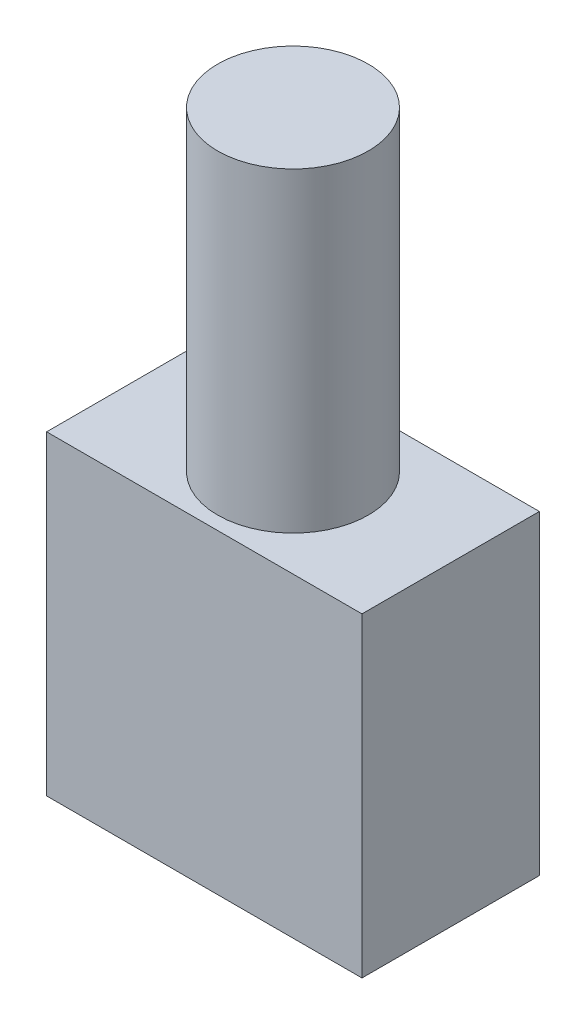
from build123d import *

# Parameters (mm, degrees)
SKETCH_1_W          = 80
SKETCH_1_H          = 45
EXTRUDE_1_DEPTH     = 80
CUT_EXTRUDE_START   = -1
SKETCH_3_W          = 76
SKETCH_3_H          = 41
CUT_EXTRUDE_1_DEPTH = 68
CUT_EXTRUDE_1_DRAFT = -3
SKETCH_11_R         = 19.112902973
EXTRUDE_2_DEPTH     = 80


with BuildPart() as part:
    # 스케치1 → 보스-돌출1 (new body)
    with BuildSketch(Plane(origin=(0, 0, 0), x_dir=(1, 0, 0), z_dir=(0, 1, 0))):
        Rectangle(SKETCH_1_W, SKETCH_1_H)
    extrude(amount=EXTRUDE_1_DEPTH)


with BuildPart() as cut_extrude_1_tool:
    # 스케치3 → 컷-돌출1 (with draft: the straight prism first)
    with BuildSketch(Plane(origin=(0, 80, 0), x_dir=(1, 0, 0), z_dir=(0, 1, 0)).offset(CUT_EXTRUDE_START)):
        Rectangle(SKETCH_3_W, SKETCH_3_H)
    extrude(amount=-CUT_EXTRUDE_1_DEPTH)
    # 컷-돌출1: the draft: its side faces are tilted about the plane it starts from
    cut_extrude_1_sides = [cut_extrude_1_tool.faces().sort_by_distance(p)[0] for p in [
        (0, 45, 20.5),
        (38, 45, 0),
        (0, 45, -20.5),
        (-38, 45, 0),
    ]]
    draft(cut_extrude_1_sides, Plane(origin=(0, 80, 0), x_dir=(1, 0, 0), z_dir=(0, 1, 0)).offset(CUT_EXTRUDE_START), CUT_EXTRUDE_1_DRAFT)


with BuildPart() as part_1:
    add(part.part)

    # 컷-돌출1: cut by cut_extrude_1_tool
    add(cut_extrude_1_tool.part, mode=Mode.SUBTRACT)

    # 스케치11 → 보스-돌출2 (add)
    with BuildSketch(Plane(origin=(0, 80, 0), x_dir=(1, 0, 0), z_dir=(0, 1, 0))):
        with Locations(Location((0, 0, 0), (0, 0, 270))):
            Circle(SKETCH_11_R)
    extrude(amount=EXTRUDE_2_DEPTH)


solid = part_1.part
